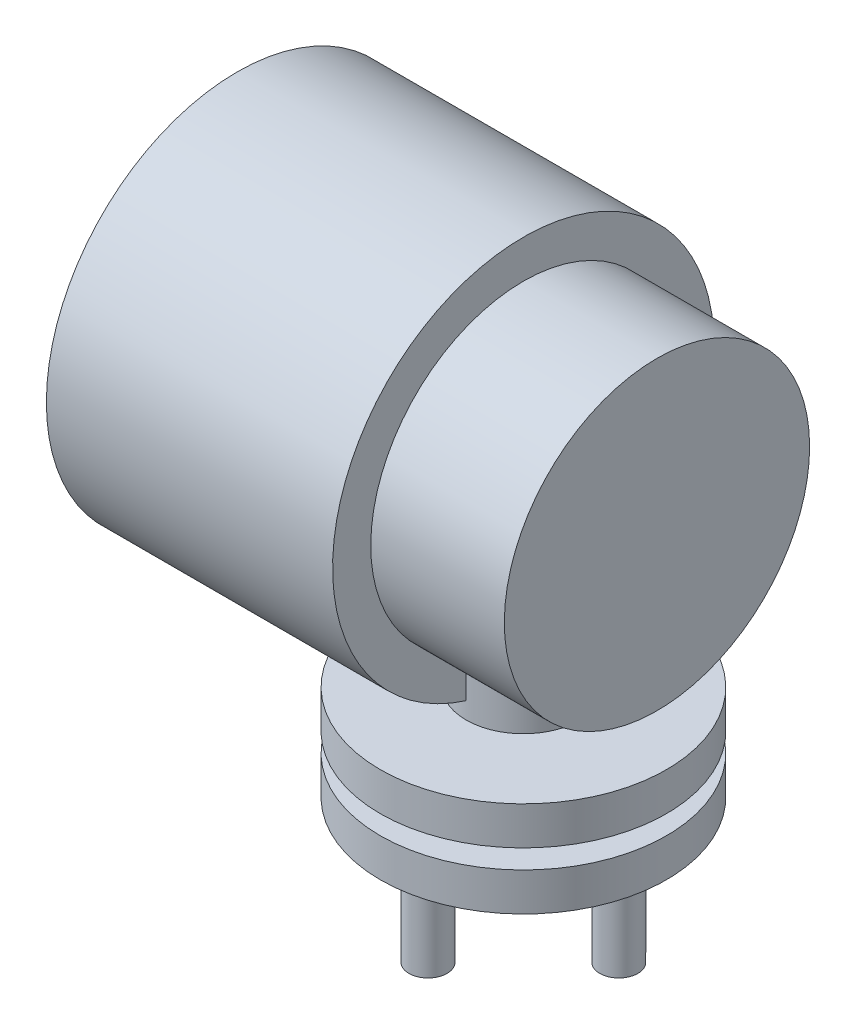
from build123d import *

# Parameters (mm, degrees)
SKETCH1_R           = 75
BOSS_EXTRUDE1_DEPTH = 20
SKETCH2_R           = 60
BOSS_EXTRUDE2_DEPTH = 10
SKETCH3_R           = 75
BOSS_EXTRUDE3_DEPTH = 20
SKETCH4_R           = 30
BOSS_EXTRUDE4_DEPTH = 100
SKETCH5_R           = 100
BOSS_EXTRUDE5_DEPTH = 150
SKETCH6_R           = 80
BOSS_EXTRUDE6_DEPTH = 70
SKETCH7_R           = 10
BOSS_EXTRUDE7_DEPTH = 40
SKETCH13_R          = 25
CUT_EXTRUDE1_DEPTH  = 120
SKETCH14_R          = 10
BOSS_EXTRUDE8_DEPTH = 10


with BuildPart() as part:
    # Sketch1 → Boss-Extrude1 (new body)
    with BuildSketch(Plane(origin=(0, 0, 0), x_dir=(1, 0, 0), z_dir=(0, 1, 0))):
        with Locations(Location((0, 0, 0), (0, 0, 270))):
            Circle(SKETCH1_R)
    extrude(amount=BOSS_EXTRUDE1_DEPTH)

    # Sketch2 → Boss-Extrude2 (add)
    with BuildSketch(Plane(origin=(0, 20, 0), x_dir=(1, 0, 0), z_dir=(0, 1, 0))):
        with Locations(Location((0, 0, 0), (0, 0, 270))):
            Circle(SKETCH2_R)
    extrude(amount=BOSS_EXTRUDE2_DEPTH)

    # Sketch3 → Boss-Extrude3 (add)
    with BuildSketch(Plane(origin=(0, 30, 0), x_dir=(1, 0, 0), z_dir=(0, 1, 0))):
        with Locations(Location((0, 0, 0), (0, 0, 270))):
            Circle(SKETCH3_R)
    extrude(amount=BOSS_EXTRUDE3_DEPTH)

    # Sketch4 → Boss-Extrude4 (add)
    with BuildSketch(Plane(origin=(0, 50, 0), x_dir=(1, 0, 0), z_dir=(0, 1, 0))):
        with Locations(Location((0, 0, 0), (0, 0, 270))):
            Circle(SKETCH4_R)
    extrude(amount=BOSS_EXTRUDE4_DEPTH)

    # Sketch5 → Boss-Extrude5 (add)
    with BuildSketch(Plane(origin=(0, 0, 0), x_dir=(0, 0, -1), z_dir=(1, 0, 0))):
        with Locations((0, 154.201763101)):
            Circle(SKETCH5_R)
    extrude(amount=-BOSS_EXTRUDE5_DEPTH)

    # Sketch6 → Boss-Extrude6 (add)
    with BuildSketch(Plane(origin=(0, 0, 0), x_dir=(0, 0, -1), z_dir=(1, 0, 0))):
        with Locations(Location((0, 154.201763101, 0), (0, 0, 247.975687163))):
            Circle(SKETCH6_R)
    extrude(amount=BOSS_EXTRUDE6_DEPTH)

    # Sketch7 → Boss-Extrude7 (add)
    with BuildSketch(Plane(origin=(0, 0, 0), x_dir=(-1, 0, 0), z_dir=(0, -1, 0))):
        with Locations(Location((0, 50, 0), (0, 0, 270))):
            Circle(SKETCH7_R)
        with Locations(Location((-50, 0, 0), (0, 0, 270))):
            Circle(SKETCH7_R)
        with Locations(Location((0, -50, 0), (0, 0, 270))):
            Circle(SKETCH7_R)
        with Locations(Location((50, 0, 0), (0, 0, 270))):
            Circle(SKETCH7_R)
    extrude(amount=BOSS_EXTRUDE7_DEPTH)

    # Sketch13 → Cut-Extrude1 (cut)
    with BuildSketch(Plane(origin=(0, 0, 0), x_dir=(-1, 0, 0), z_dir=(0, -1, 0))):
        with Locations(Location((0, 0, 0), (0, 0, 90))):
            Circle(SKETCH13_R)
    extrude(amount=-CUT_EXTRUDE1_DEPTH, mode=Mode.SUBTRACT)

    # Sketch14 → Boss-Extrude8 (add)
    with BuildSketch(Plane(origin=(0, -40, 0), x_dir=(-1, 0, 0), z_dir=(0, -1, 0))):
        with Locations(Location((0, 50, 0), (0, 0, 270))):
            Circle(SKETCH14_R)
        with Locations(Location((50, 0, 0), (0, 0, 270))):
            Circle(SKETCH14_R)
        with Locations(Location((0, -50, 0), (0, 0, 270))):
            Circle(SKETCH14_R)
        with Locations(Location((-50, 0, 0), (0, 0, 270))):
            Circle(SKETCH14_R)
    extrude(amount=BOSS_EXTRUDE8_DEPTH)


solid = part.part
